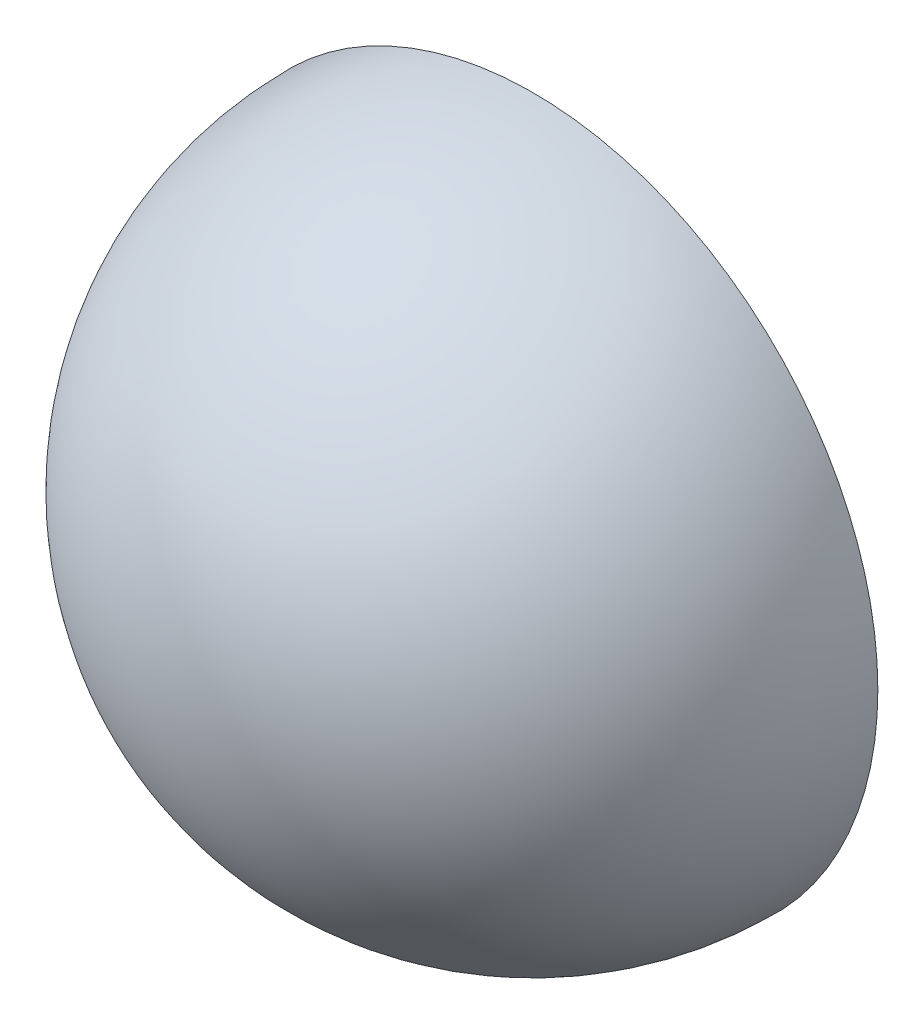
from build123d import *

# Parameters (mm, degrees)
SKETCH2_W          = 196.582077134
SKETCH2_H          = 129.767310393
CUT_EXTRUDE1_DEPTH = 51


with BuildPart() as part:
    # Sketch1 → Revolve1 (revolve)
    with BuildSketch(Plane.XY):
        with BuildLine():
            Line((0, 45), (0, 60))
            ThreePointArc((0, 60), (-30, 30), (0, 0))
            Line((0, 0), (0, 15))
            ThreePointArc((0, 15), (-15, 30), (0, 45))
        make_face()
    revolve(axis=Axis((0, 0, 0), (0, 1, 0)))

    # Sketch2 → Cut-Extrude1 (cut)
    with BuildSketch(Plane.XY):
        with Locations((-0.844415796, 35.396343626)):
            Rectangle(SKETCH2_W, SKETCH2_H)
    extrude(amount=-CUT_EXTRUDE1_DEPTH, mode=Mode.SUBTRACT)


solid = part.part
